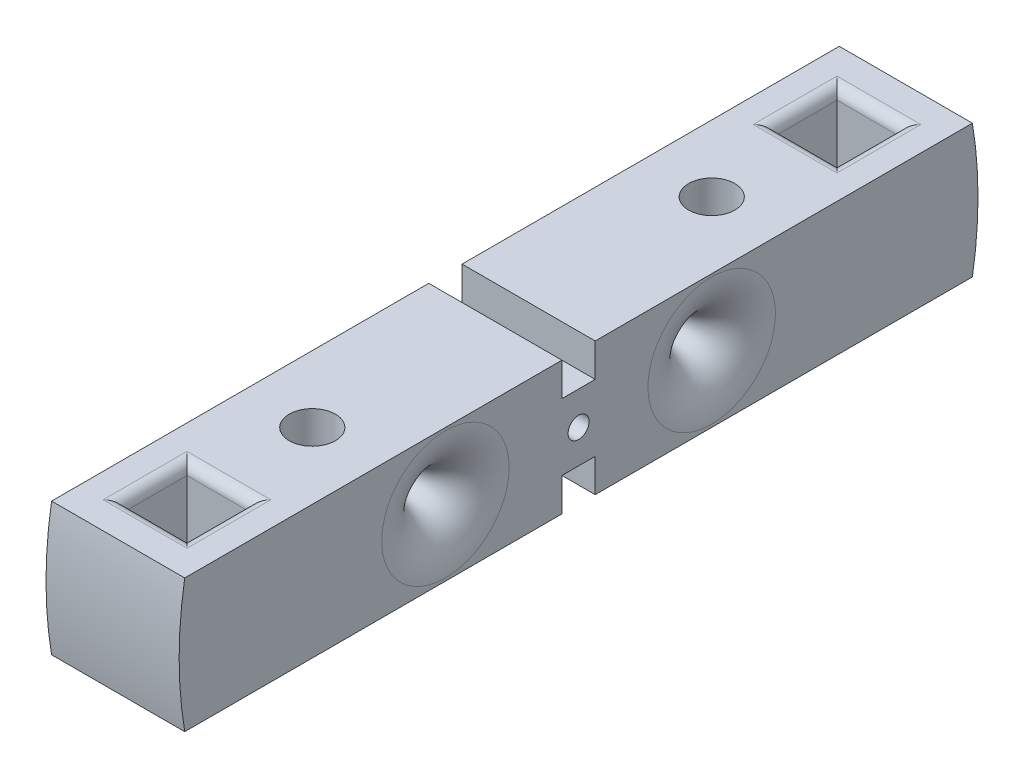
from build123d import *

# Parameters (mm, degrees)
SKETCH1_R                = 0.5
BOSS_EXTRUDE1_DEPTH      = 6.35
SKETCH2_W                = 3
SKETCH2_H                = 3
CUT_EXTRUDE1_DEPTH       = 6.35
FILLET1_R                = 2.54
M2_CLEARANCE_HOLE1_D     = 2.2
M2_CLEARANCE_HOLE1_DEPTH = 28.34894
M2_CLEARANCE_HOLE1_TIP   = 0.660946681
FILLET2_R                = 0.5
SKETCH6_W                = 1.5875
SKETCH6_H                = 1.5875
CUT_EXTRUDE2_DEPTH       = 21.329919454


with BuildPart() as part:
    # Sketch1 → Boss-Extrude1 (new body)
    with BuildSketch(Plane(origin=(0, 0, 0), x_dir=(0, 0, -1), z_dir=(1, 0, 0))):
        with BuildLine():
            Line((-18.783553311, 3.175), (18.783553311, 3.175))
            ThreePointArc((18.783553311, 3.175), (19.05, 0), (18.783553311, -3.175))
            Line((18.783553311, -3.175), (-18.783553311, -3.175))
            ThreePointArc((-18.783553311, -3.175), (-19.05, 0), (-18.783553311, 3.175))
        make_face()
        with Locations((6.35, 0)):
            Circle(SKETCH1_R, mode=Mode.SUBTRACT)
        with Locations((-6.35, 0)):
            Circle(SKETCH1_R, mode=Mode.SUBTRACT)
        Circle(SKETCH1_R, mode=Mode.SUBTRACT)
    extrude(amount=BOSS_EXTRUDE1_DEPTH)

    # Sketch2 → Cut-Extrude1 (cut)
    with BuildSketch(Plane(origin=(0, 3.175, 0), x_dir=(1, 0, 0), z_dir=(0, 1, 0))):
        with Locations((3.175, -15.5)):
            Rectangle(SKETCH2_W, SKETCH2_H)
        with Locations((3.175, 15.5)):
            Rectangle(SKETCH2_W, SKETCH2_H)
    extrude(amount=-CUT_EXTRUDE1_DEPTH, mode=Mode.SUBTRACT)

    # Fillet1
    fillet1_edges = [part.edges().sort_by_distance(p)[0] for p in [
        (0, 0, -5.85),
        (6.35, 0, -5.85),
        (0, 0, 6.85),
        (6.35, 0, 6.85),
    ]]
    fillet(fillet1_edges, radius=FILLET1_R)

    # M2 Clearance Hole1
    with Locations(Plane.XZ.offset(3.175)):
        with Locations((3.175, 9.525), (3.175, -9.525)):
            Hole(M2_CLEARANCE_HOLE1_D / 2, depth=M2_CLEARANCE_HOLE1_DEPTH)
            with Locations((0, 0, -(M2_CLEARANCE_HOLE1_DEPTH + M2_CLEARANCE_HOLE1_TIP / 2))):  # 118° drill point
                Cone(0, M2_CLEARANCE_HOLE1_D / 2, M2_CLEARANCE_HOLE1_TIP, mode=Mode.SUBTRACT)

    # Fillet2
    fillet2_edges = [part.edges().sort_by_distance(p)[0] for p in [
        (1.675, -3.175, 15.5),
        (3.175, -3.175, 14),
        (4.675, -3.175, 15.5),
        (3.175, -3.175, 17),
        (1.675, 3.175, 15.5),
        (3.175, 3.175, 17),
        (4.675, 3.175, 15.5),
        (3.175, 3.175, 14),
        (3.175, -3.175, -17),
        (4.675, -3.175, -15.5),
        (3.175, -3.175, -14),
        (1.675, -3.175, -15.5),
        (3.175, 3.175, -17),
        (1.675, 3.175, -15.5),
        (3.175, 3.175, -14),
        (4.675, 3.175, -15.5),
    ]]
    fillet(fillet2_edges, radius=FILLET2_R)

    # Sketch6 → Cut-Extrude2 (cut, through all)
    with BuildSketch(Plane.ZY):
        with Locations((0, -2.38125)):
            Rectangle(SKETCH6_W, SKETCH6_H)
        with Locations((0, 2.38125)):
            Rectangle(SKETCH6_W, SKETCH6_H)
    extrude(amount=-CUT_EXTRUDE2_DEPTH, mode=Mode.SUBTRACT)


solid = part.part
